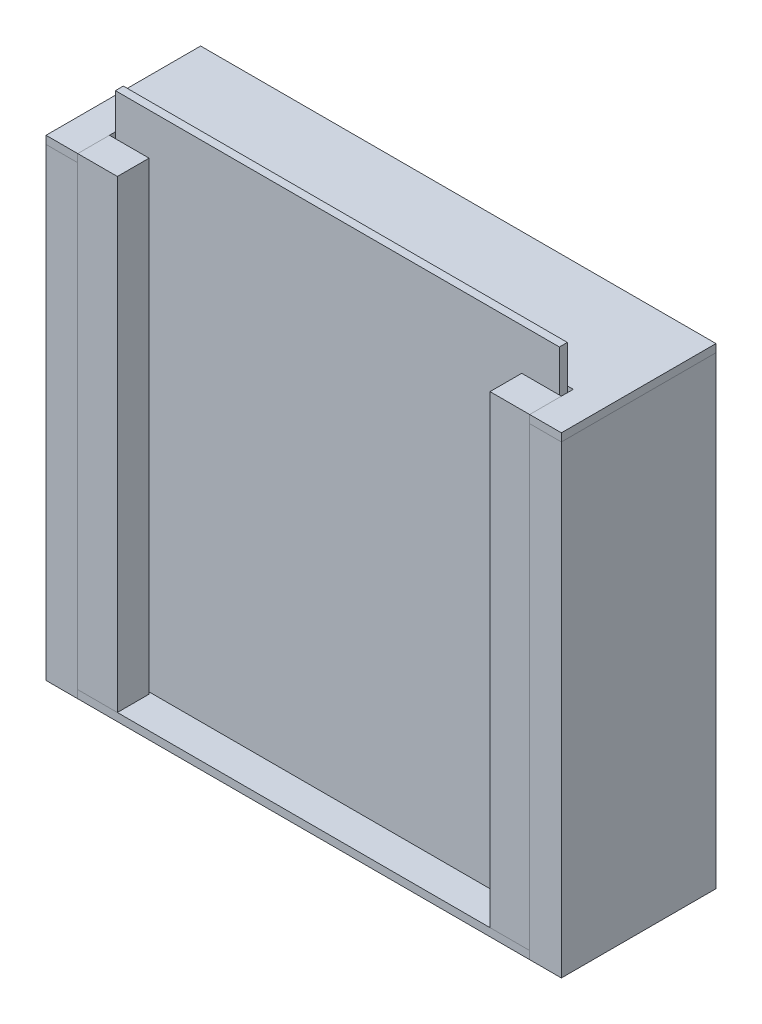
from build123d import *

# Parameters (mm, degrees)
SKETCH_6_W          = 4
SKETCH_6_H          = 58.55
EXTRUDE_8_DEPTH     = 19.5
EXTRUDE_8_2_DEPTH   = 19.5
EXTRUDE_9_DEPTH     = 1
SKETCH_8_W          = 5
SKETCH_8_H          = 4
EXTRUDE_10_DEPTH    = 58.55
EXTRUDE_10_2_DEPTH  = 58.55
SKETCH_8_3_W        = 5
SKETCH_8_3_H        = 4
EXTRUDE_11_DEPTH    = 59.55
EXTRUDE_11_2_DEPTH  = 59.55
SKETCH_9_W          = 56
SKETCH_9_H          = 1
EXTRUDE_12_DEPTH    = 59.55
SKETCH_10_W         = 56
SKETCH_10_H         = 1
EXTRUDE_13_DEPTH    = 5
SKETCH_11_W         = 5
SKETCH_11_H         = 4
CUT_EXTRUDE_5_DEPTH = 1
SKETCH_12_W         = 57
SKETCH_12_H         = 9.5
EXTRUDE_14_DEPTH    = 1
SKETCH_13_W         = 56
SKETCH_13_H         = 1
CUT_EXTRUDE_6_DEPTH = 1
SKETCH_14_W         = 57
SKETCH_14_H         = 9.5
EXTRUDE_15_DEPTH    = 1


with BuildPart() as part:
    # 스케치6 → 보스-돌출8 (new body)
    with BuildSketch(Plane.XY):
        with Locations((-30.5, 150.775)):
            Rectangle(SKETCH_6_W, SKETCH_6_H)
    extrude(amount=EXTRUDE_8_DEPTH)


with BuildPart() as body_2:
    # 스케치6 → Extrude 8 2 (new body)
    with BuildSketch(Plane.XY):
        with Locations((30.5, 150.775)):
            Rectangle(SKETCH_6_W, SKETCH_6_H)
    extrude(amount=EXTRUDE_8_2_DEPTH)


with BuildPart() as body_3:
    # 스케치7 → 보스-돌출9 (new body)
    with BuildSketch(Plane(origin=(0, 180.05, 0), x_dir=(1, 0, 0), z_dir=(0, 1, 0))):
        Polygon((-32.5, 0), (-32.5, -19.5), (-28.5, -19.5), (-28.5, -14), (28.5, -14), (28.5, -19.5), (32.5, -19.5), (32.5, 0), align=None)
    extrude(amount=EXTRUDE_9_DEPTH)


with BuildPart() as body_4:
    # 스케치8 → 보스-돌출10 (new body)
    with BuildSketch(Plane.XZ.offset(-121.5)):
        with Locations((-26, 12)):
            Rectangle(SKETCH_8_W, SKETCH_8_H)
    extrude(amount=-EXTRUDE_10_DEPTH)


with BuildPart() as body_5:
    # 스케치8 → Extrude 10 2 (new body)
    with BuildSketch(Plane.XZ.offset(-121.5)):
        with Locations((26, 12)):
            Rectangle(SKETCH_8_W, SKETCH_8_H)
    extrude(amount=-EXTRUDE_10_2_DEPTH)


with BuildPart() as body_6:
    # 스케치8<3> → 보스-돌출11 (new body)
    with BuildSketch(Plane.XZ.offset(-121.5)):
        with Locations((-26, 17.5)):
            Rectangle(SKETCH_8_3_W, SKETCH_8_3_H)
    extrude(amount=-EXTRUDE_11_DEPTH)


with BuildPart() as body_7:
    # 스케치8<3> → Extrude 11 2 (new body)
    with BuildSketch(Plane.XZ.offset(-121.5)):
        with Locations((26, 17.5)):
            Rectangle(SKETCH_8_3_W, SKETCH_8_3_H)
    extrude(amount=-EXTRUDE_11_2_DEPTH)


with BuildPart() as body_8:
    # 스케치9 → 보스-돌출12 (new body)
    with BuildSketch(Plane(origin=(0, 181.05, 0), x_dir=(1, 0, 0), z_dir=(0, 1, 0))):
        with Locations((0, -14.75)):
            Rectangle(SKETCH_9_W, SKETCH_9_H)
    extrude(amount=-EXTRUDE_12_DEPTH)

    # 스케치10 → 보스-돌출13 (add)
    with BuildSketch(Plane(origin=(0, 181.05, 0), x_dir=(1, 0, 0), z_dir=(0, 1, 0))):
        with Locations((0, -14.75)):
            Rectangle(SKETCH_10_W, SKETCH_10_H)
    extrude(amount=EXTRUDE_13_DEPTH)

    # 스케치13 → 컷-돌출6 (cut)
    with BuildSketch(Plane.XZ.offset(-121.5)):
        with Locations((0, 14.75)):
            Rectangle(SKETCH_13_W, SKETCH_13_H)
    extrude(amount=-CUT_EXTRUDE_6_DEPTH, mode=Mode.SUBTRACT)


with BuildPart() as cut_extrude_5_tool:
    # 스케치11 → 컷-돌출5 (new body)
    with BuildSketch(Plane.XZ.offset(-121.5)):
        with Locations((-26, 17.5)):
            Rectangle(SKETCH_11_W, SKETCH_11_H)
        with Locations((-26, 12)):
            Rectangle(SKETCH_11_W, SKETCH_11_H)
        with Locations((26, 12)):
            Rectangle(SKETCH_11_W, SKETCH_11_H)
        with Locations((26, 17.5)):
            Rectangle(SKETCH_11_W, SKETCH_11_H)
    extrude(amount=-CUT_EXTRUDE_5_DEPTH)


with BuildPart() as body_4_1:
    add(body_4.part)

    # 컷-돌출5: cut by cut_extrude_5_tool
    add(cut_extrude_5_tool.part, mode=Mode.SUBTRACT)


with BuildPart() as body_5_1:
    add(body_5.part)

    # 컷-돌출5: cut by cut_extrude_5_tool
    add(cut_extrude_5_tool.part, mode=Mode.SUBTRACT)


with BuildPart() as body_6_1:
    add(body_6.part)

    # 컷-돌출5: cut by cut_extrude_5_tool
    add(cut_extrude_5_tool.part, mode=Mode.SUBTRACT)


with BuildPart() as body_7_1:
    add(body_7.part)

    # 컷-돌출5: cut by cut_extrude_5_tool
    add(cut_extrude_5_tool.part, mode=Mode.SUBTRACT)


with BuildPart() as body_9:
    # 스케치12 → 보스-돌출14 (new body)
    with BuildSketch(Plane.XZ.offset(-121.5)):
        with Locations((0, 14.75)):
            Rectangle(SKETCH_12_W, SKETCH_12_H)
    extrude(amount=-EXTRUDE_14_DEPTH)


with BuildPart() as body_10:
    # 스케치14 → 보스-돌출15 (new body)
    with BuildSketch(Plane.XZ.offset(-121.5)):
        with Locations((0, 14.75)):
            Rectangle(SKETCH_14_W, SKETCH_14_H)
    extrude(amount=-EXTRUDE_15_DEPTH)


solid = Compound([part.part, body_2.part, body_3.part, body_8.part, body_4_1.part, body_5_1.part, body_6_1.part, body_7_1.part, body_9.part])
